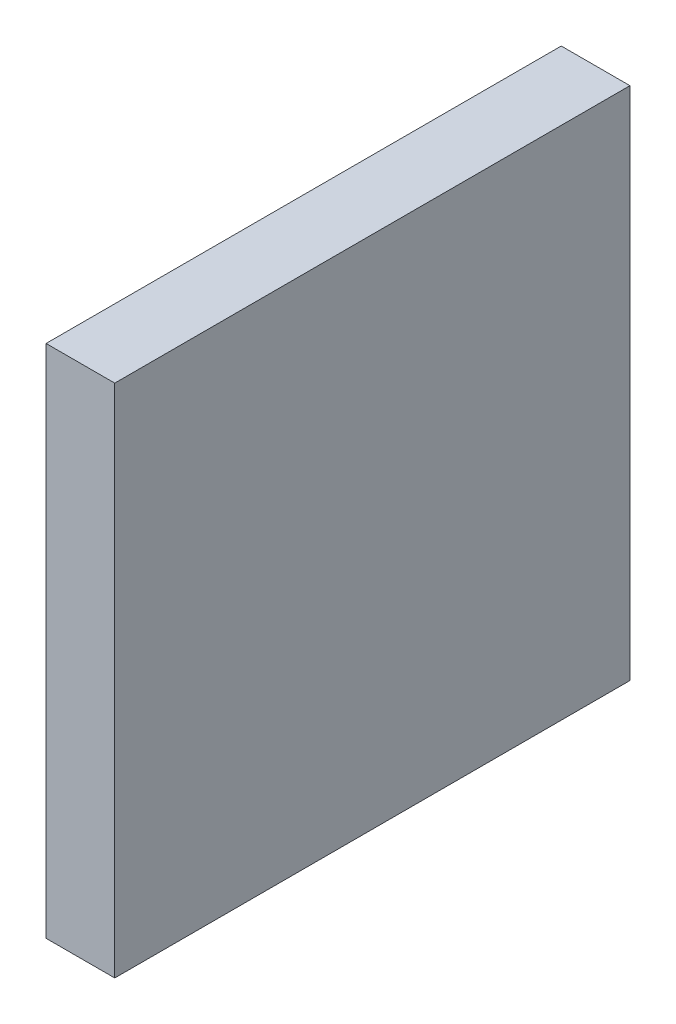
from build123d import *

# Parameters (mm, degrees)
SKETCH1_W           = 27
SKETCH1_H           = 27
BOSS_EXTRUDE1_DEPTH = 3.6
SKETCH2_W           = 3.5
SKETCH2_H           = 10
CUT_EXTRUDE1_DEPTH  = 3


with BuildPart() as part:
    # Sketch1 → Boss-Extrude1 (new body)
    with BuildSketch(Plane(origin=(0, 0, 0), x_dir=(0, 0, -1), z_dir=(1, 0, 0))):
        Rectangle(SKETCH1_W, SKETCH1_H)
    extrude(amount=BOSS_EXTRUDE1_DEPTH)

    # Sketch2 → Cut-Extrude1 (cut)
    with BuildSketch(Plane.ZY):
        with BuildLine():
            Line((-2.5, -7), (-2.5, -9))
            Line((-2.5, -9), (2.5, -9))
            Line((2.5, -9), (2.5, -7))
            ThreePointArc((2.5, -7), (0, -4.5), (-2.5, -7))
        make_face()
        with Locations((-7.5, 4.5)):
            Rectangle(SKETCH2_W, SKETCH2_H)
        with Locations((7.5, 4.5)):
            Rectangle(SKETCH2_W, SKETCH2_H)
    extrude(amount=-CUT_EXTRUDE1_DEPTH, mode=Mode.SUBTRACT)


solid = part.part
